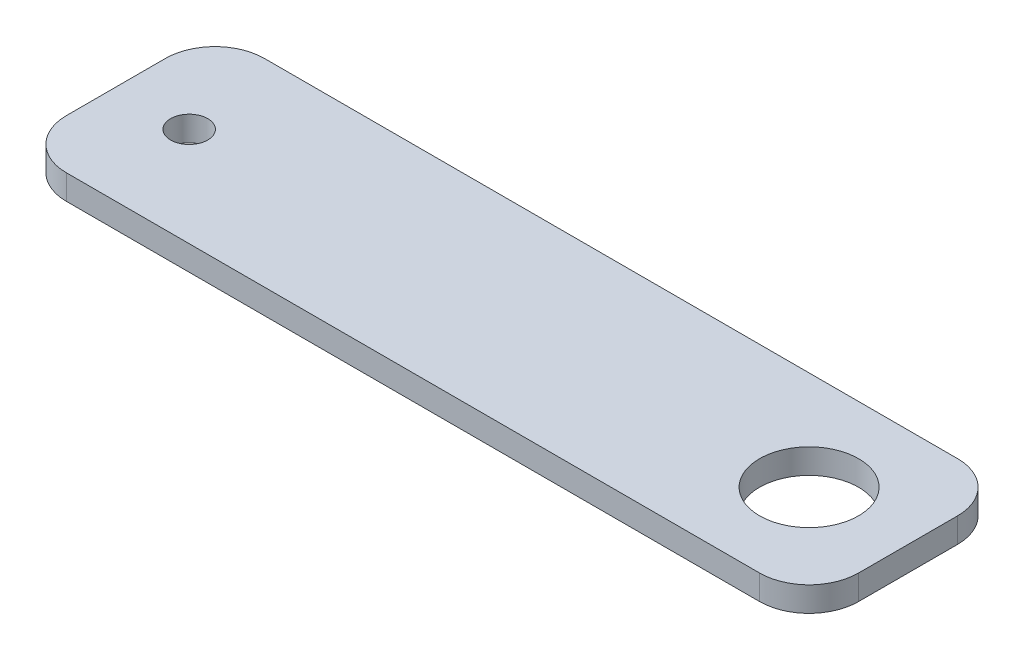
from build123d import *

# Parameters (mm, degrees)
SKETCH1_W           = 50.8
SKETCH1_H           = 12.7
BOSS_EXTRUDE1_DEPTH = 1.5875
SKETCH2_R           = 1.190625
SKETCH2_R_2         = 3.175
CUT_EXTRUDE1_DEPTH  = 53.3875
FILLET1_R           = 3.175


with BuildPart() as part:
    # Sketch1 → Boss-Extrude1 (new body)
    with BuildSketch(Plane(origin=(0, 0, 0), x_dir=(1, 0, 0), z_dir=(0, 1, 0))):
        with Locations((25.4, 6.35)):
            Rectangle(SKETCH1_W, SKETCH1_H)
    extrude(amount=BOSS_EXTRUDE1_DEPTH)

    # Sketch2 → Cut-Extrude1 (cut, through all)
    with BuildSketch(Plane(origin=(0, 1.5875, 0), x_dir=(1, 0, 0), z_dir=(0, 1, 0))):
        with Locations(Location((4.699, 6.35, 0), (0, 0, 270))):
            Circle(SKETCH2_R)
        with Locations(Location((44.45, 6.35, 0), (0, 0, 270))):
            Circle(SKETCH2_R_2)
    extrude(amount=-CUT_EXTRUDE1_DEPTH, mode=Mode.SUBTRACT)

    # Fillet1
    fillet1_edges = [part.edges().sort_by_distance(p)[0] for p in [
        (0, 0.79375, -12.7),
        (50.8, 0.79375, -12.7),
        (50.8, 0.79375, 0),
        (0, 0.79375, 0),
    ]]
    fillet(fillet1_edges, radius=FILLET1_R)


solid = part.part
